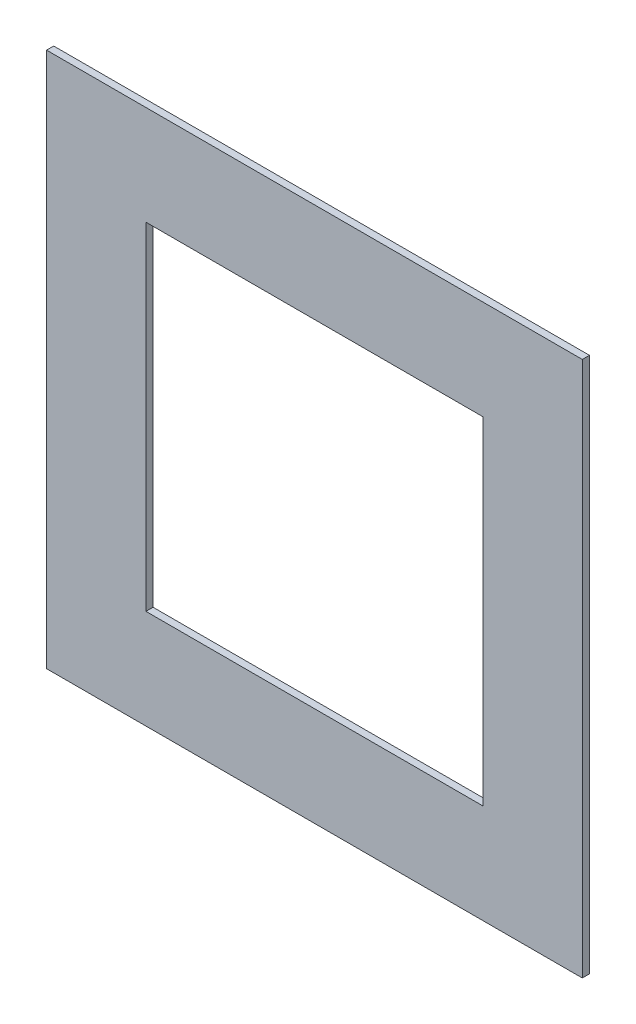
from build123d import *

# Parameters (mm, degrees)
SKIZZE1_W                       = 1200
SKIZZE1_H                       = 1200
SKIZZE1_W_2                     = 755
SKIZZE1_H_2                     = 755
AUFSATZ_LINEAR_AUSTRAGEN1_DEPTH = 16


with BuildPart() as part:
    # Skizze1 → Aufsatz-Linear austragen1 (new body)
    with BuildSketch(Plane.XY):
        Rectangle(SKIZZE1_W, SKIZZE1_H)
        Rectangle(SKIZZE1_W_2, SKIZZE1_H_2, mode=Mode.SUBTRACT)
    extrude(amount=AUFSATZ_LINEAR_AUSTRAGEN1_DEPTH)


solid = part.part
